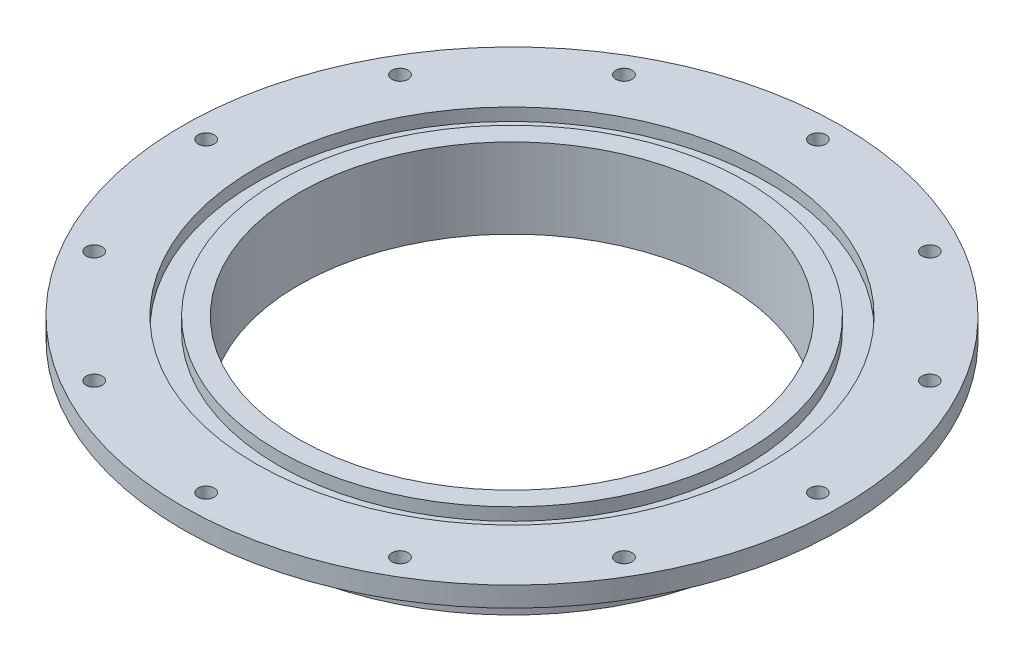
from build123d import *

# Parameters (mm, degrees)
SKETCH1_R                    = 80.518
SKETCH1_R_2                  = 67.818
INNER_CYLINDER_DEPTH         = 19.05
SKETCH2_R                    = 104.775
SKETCH2_R_2                  = 67.818
FLANGE_DEPTH                 = 6.35
SKETCH4_R                    = 81.407
SKETCH4_R_2                  = 74.295
GROOVE_DEPTH                 = 3.9878
SKETCH5_R                    = 2.5527
F_10_32_CLEARANCE_HOLE_DEPTH = 6.35
CIRPATTERN1_COUNT            = 12


with BuildPart() as part:
    # Sketch1 → Inner Cylinder (new body)
    with BuildSketch(Plane(origin=(0, 0, 0), x_dir=(1, 0, 0), z_dir=(0, 1, 0))):
        with Locations(Location((0, 0, 0), (0, 0, 90))):
            Circle(SKETCH1_R)
        with Locations(Location((0, 0, 0), (0, 0, 90))):
            Circle(SKETCH1_R_2, mode=Mode.SUBTRACT)
    extrude(amount=INNER_CYLINDER_DEPTH)

    # Sketch2 → Flange (add)
    with BuildSketch(Plane(origin=(0, 19.05, 0), x_dir=(1, 0, 0), z_dir=(0, 1, 0))):
        with Locations(Location((0, 0, 0), (0, 0, 270))):
            Circle(SKETCH2_R)
        with Locations(Location((0, 0, 0), (0, 0, 90))):
            Circle(SKETCH2_R_2, mode=Mode.SUBTRACT)
    extrude(amount=FLANGE_DEPTH)

    # Sketch4 → Groove (cut)
    with BuildSketch(Plane(origin=(0, 25.4, 0), x_dir=(1, 0, 0), z_dir=(0, 1, 0))):
        with Locations(Location((0, 0, 0), (0, 0, 270))):
            Circle(SKETCH4_R)
        with Locations(Location((0, 0, 0), (0, 0, 270))):
            Circle(SKETCH4_R_2, mode=Mode.SUBTRACT)
    extrude(amount=-GROOVE_DEPTH, mode=Mode.SUBTRACT)

    # Sketch5 → 10-32 Clearance Hole (cut)
    with BuildSketch(Plane(origin=(0, 25.4, 0), x_dir=(1, 0, 0), z_dir=(0, 1, 0))):
        with Locations(Location((0, -97.25025, 0), (0, 0, 270))):
            Circle(SKETCH5_R)
    f_10_32_clearance_hole = extrude(amount=-F_10_32_CLEARANCE_HOLE_DEPTH, mode=Mode.SUBTRACT)

    # CirPattern1: 10-32 Clearance Hole ×12 about axis
    cirpattern1_axis = Axis((0, 0, 0), (0, 1, 0))
    for i in range(1, CIRPATTERN1_COUNT):
        add(f_10_32_clearance_hole.rotate(cirpattern1_axis, i * 360 / CIRPATTERN1_COUNT), mode=Mode.SUBTRACT)


solid = part.part
